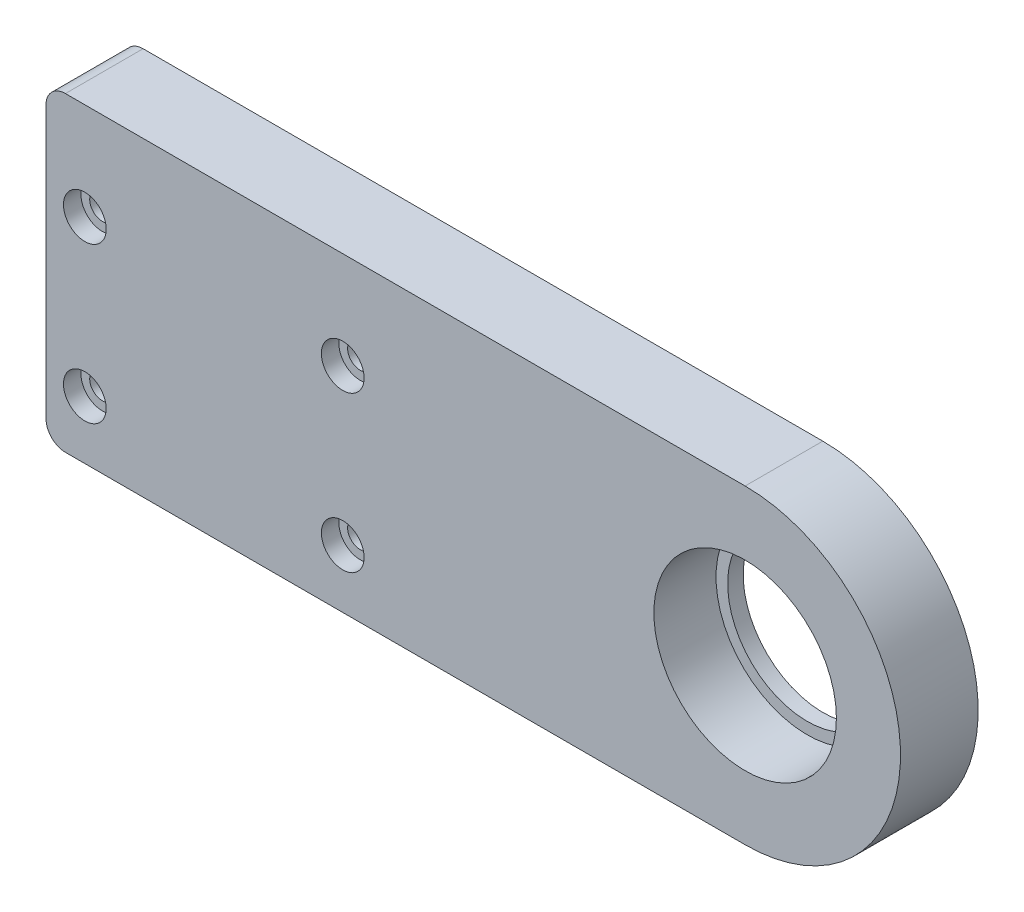
from build123d import *

# Parameters (mm, degrees)
SKETCH1_R           = 20.5
BOSS_EXTRUDE1_DEPTH = 20
SKETCH2_R           = 23.5
CUT_EXTRUDE1_DEPTH  = 16
SKETCH4_W           = 85
SKETCH4_H           = 8
BOSS_EXTRUDE2_DEPTH = 3
SKETCH3_R           = 3.25
CUT_EXTRUDE2_DEPTH  = 186.819805188
SKETCH5_R           = 5.5
CUT_EXTRUDE3_DEPTH  = 4.5
FILLET1_R           = 5


with BuildPart() as part:
    # Sketch1 → Boss-Extrude1 (new body)
    with BuildSketch(Plane.XY):
        with BuildLine():
            Line((0, 40), (-180, 40))
            Line((-180, 40), (-180, -40))
            Line((-180, -40), (0, -40))
            ThreePointArc((0, -40), (40, 0), (0, 40))
        make_face()
        Circle(SKETCH1_R, mode=Mode.SUBTRACT)
    extrude(amount=BOSS_EXTRUDE1_DEPTH)

    # Sketch2 → Cut-Extrude1 (cut)
    with BuildSketch(Plane.XY.offset(20)):
        Circle(SKETCH2_R)
    extrude(amount=-CUT_EXTRUDE1_DEPTH, mode=Mode.SUBTRACT)

    # Sketch4 → Boss-Extrude2 (add)
    with BuildSketch(Plane(origin=(0, 0, 0), x_dir=(-1, 0, 0), z_dir=(0, 0, -1))):
        with Locations((137.5, -25)):
            Rectangle(SKETCH4_W, SKETCH4_H)
        with Locations((137.5, 15)):
            Rectangle(SKETCH4_W, SKETCH4_H)
    extrude(amount=BOSS_EXTRUDE2_DEPTH)

    # Sketch3 → Cut-Extrude2 (cut, through all)
    with BuildSketch(Plane.XY.offset(20)):
        with Locations((-103.6, 15)):
            Circle(SKETCH3_R)
        with Locations((-170, 15)):
            Circle(SKETCH3_R)
        with Locations((-170, -25)):
            Circle(SKETCH3_R)
        with Locations((-103.6, -25)):
            Circle(SKETCH3_R)
    extrude(amount=-CUT_EXTRUDE2_DEPTH, mode=Mode.SUBTRACT)

    # Sketch5 → Cut-Extrude3 (cut)
    with BuildSketch(Plane.XY.offset(20)):
        with Locations((-170, 15)):
            Circle(SKETCH5_R)
        with Locations((-103.6, 15)):
            Circle(SKETCH5_R)
        with Locations((-103.6, -25)):
            Circle(SKETCH5_R)
        with Locations((-170, -25)):
            Circle(SKETCH5_R)
    extrude(amount=-CUT_EXTRUDE3_DEPTH, mode=Mode.SUBTRACT)

    # Fillet1
    fillet1_edges = [part.edges().sort_by_distance(p)[0] for p in [
        (-180, -40, 10),
        (-180, 40, 10),
    ]]
    fillet(fillet1_edges, radius=FILLET1_R)


solid = part.part
